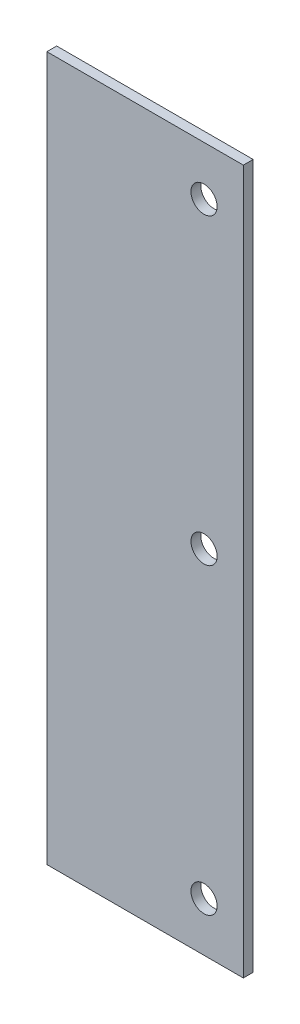
from build123d import *

# Parameters (mm, degrees)
SKETCH1_W           = 60
SKETCH1_H           = 215
SKETCH1_R           = 4
BOSS_EXTRUDE1_DEPTH = 3


with BuildPart() as part:
    # Sketch1 → Boss-Extrude1 (new body)
    with BuildSketch(Plane.XY):
        with Locations((30, 107.5)):
            Rectangle(SKETCH1_W, SKETCH1_H)
        with Locations((48, 15)):
            Circle(SKETCH1_R, mode=Mode.SUBTRACT)
        with Locations((48, 107.5)):
            Circle(SKETCH1_R, mode=Mode.SUBTRACT)
        with Locations((48, 200)):
            Circle(SKETCH1_R, mode=Mode.SUBTRACT)
    extrude(amount=BOSS_EXTRUDE1_DEPTH)


solid = part.part
